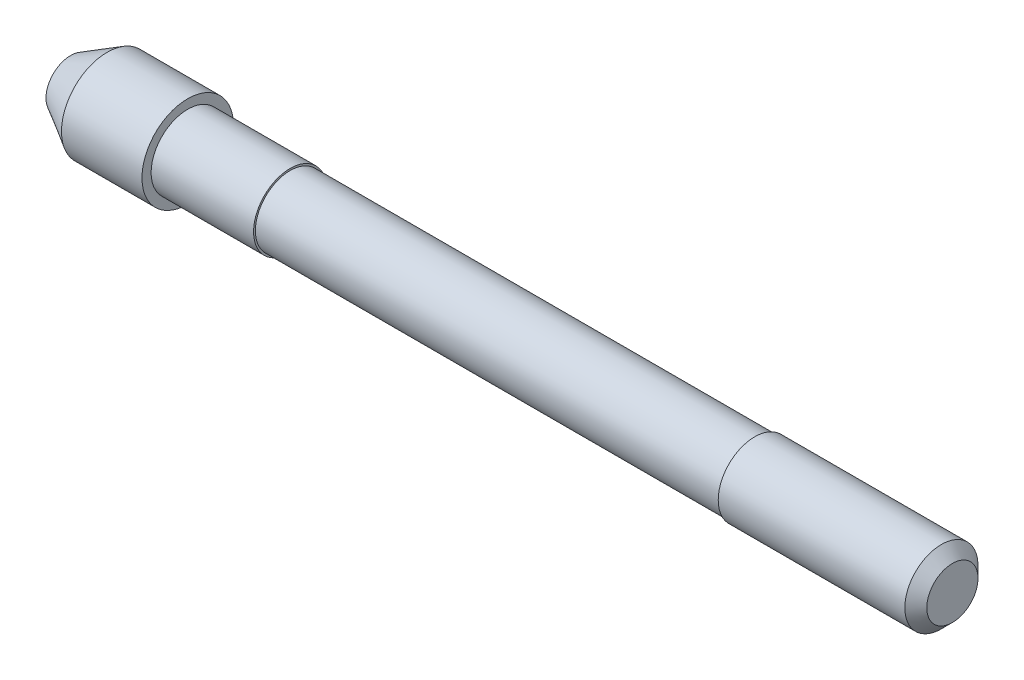
from build123d import *

# Parameters (mm, degrees)
CHANFREIN1_SIZE = 0.3


with BuildPart() as part:
    # Esquisse1 → Révolution1 (revolve)
    with BuildSketch(Plane.XY, mode=Mode.PRIVATE) as r_volution1_sk:
        Polygon((12.05, 0), (12.05, 1), (6.65, 1), (6.65, 0.95), (-6.05, 0.95), (-6.05, 1), (-8.85, 1), (-8.85, 1.25), (-11.05, 1.25), (-12.05, 0.672649731), (-12.05, 0), align=None)
    revolve(r_volution1_sk.sketch.rotate(Axis((-12.05, 0, 0), (1, 0, 0)), 90), axis=Axis((-12.05, 0, 0), (1, 0, 0)))

    # Chanfrein1
    chanfrein1_edges = [part.edges().sort_by_distance(p)[0] for p in [
        (12.05, 0, -1),
    ]]
    chamfer(chanfrein1_edges, length=CHANFREIN1_SIZE)


solid = part.part
